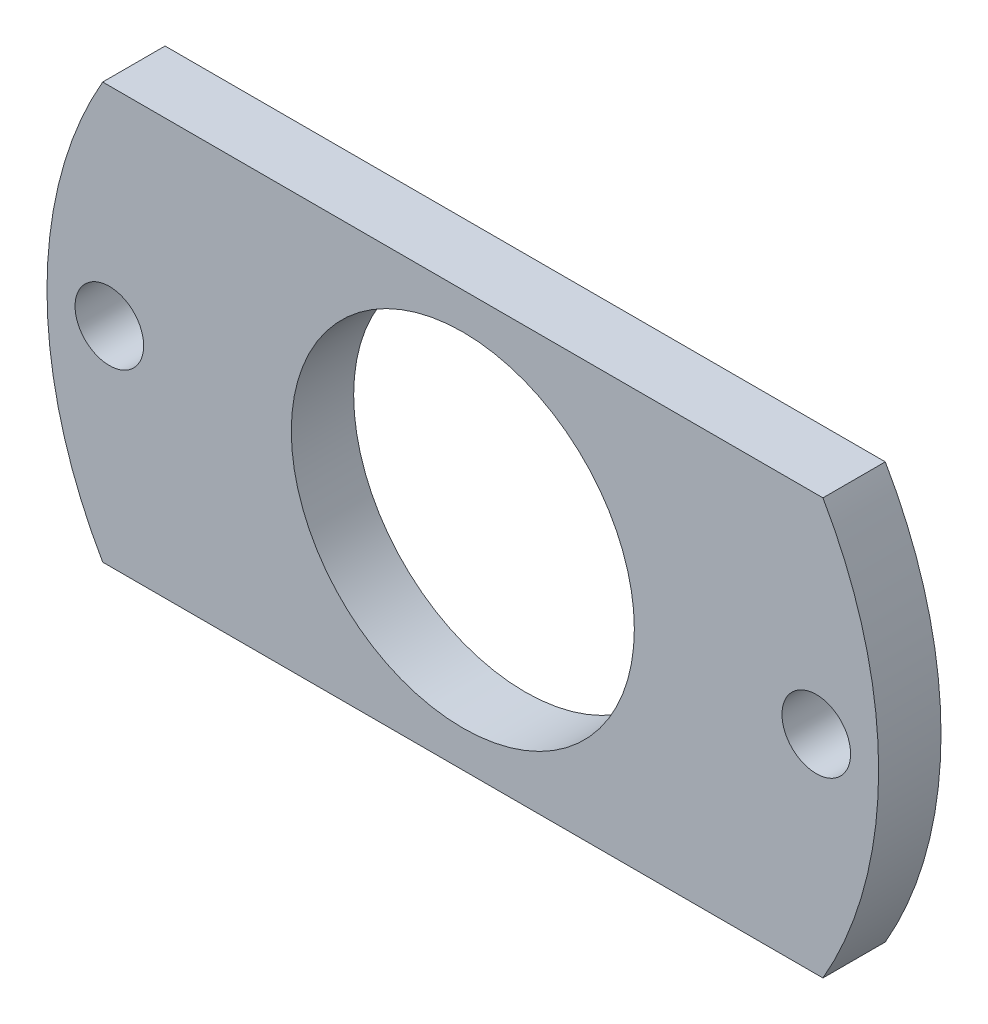
from build123d import *

# Parameters (mm, degrees)
SKETCH_1_R      = 1.65
SKETCH_1_R_2    = 8.25
EXTRUDE_1_DEPTH = 3


with BuildPart() as part:
    # 草图1 → 凸台-拉伸1 (new body)
    with BuildSketch(Plane.XY):
        with BuildLine():
            ThreePointArc((-17.320508076, 10), (-20, 0), (-17.320508076, -10))
            Line((-17.320508076, -10), (17.320508076, -10))
            ThreePointArc((17.320508076, -10), (19.318516526, -5.176380902), (20, 0))
            ThreePointArc((20, 0), (19.318516526, 5.176380902), (17.320508076, 10))
            Line((17.320508076, 10), (-17.320508076, 10))
        make_face()
        with Locations((-17, 0)):
            Circle(SKETCH_1_R, mode=Mode.SUBTRACT)
        Circle(SKETCH_1_R_2, mode=Mode.SUBTRACT)
        with Locations((17, 0)):
            Circle(SKETCH_1_R, mode=Mode.SUBTRACT)
    extrude(amount=EXTRUDE_1_DEPTH)


solid = part.part
